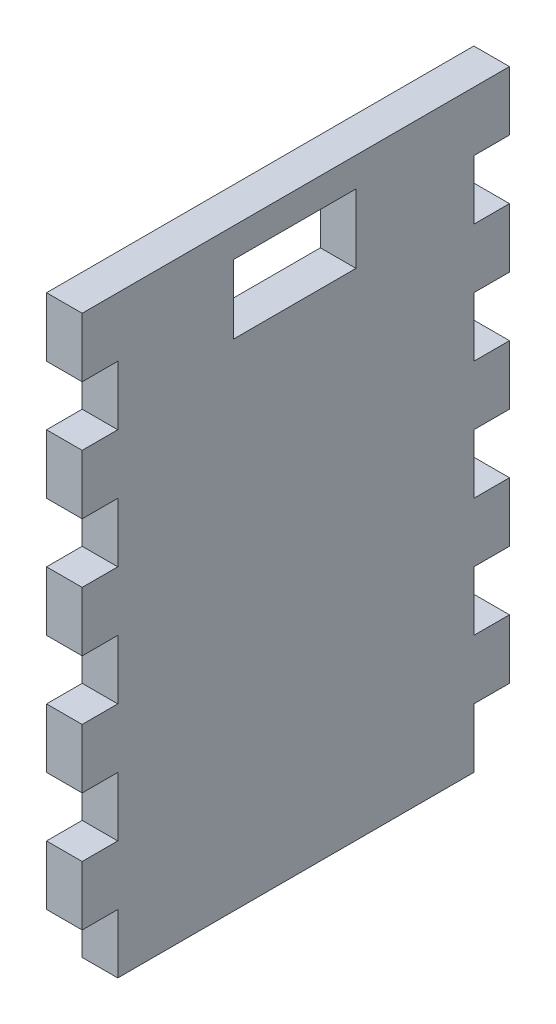
from build123d import *

# Parameters (mm, degrees)
ESBO_O1_W                = 10.3
ESBO_O1_H                = 5.8
RESSALTO_EXTRUS_O1_DEPTH = 3


with BuildPart() as part:
    # Esboço1 → Ressalto-extrusão1 (new body)
    with BuildSketch(Plane(origin=(0, 0, 0), x_dir=(0, 0, -1), z_dir=(1, 0, 0))):
        Polygon((15.984258461, 25.106612036), (15.984258461, 20.106612036), (12.984258461, 20.106612036), (12.984258461, 15.106612036), (15.984258461, 15.106612036), (15.984258461, 10.106612036), (12.984258461, 10.106612036), (12.984258461, 5.106612036), (15.984258461, 5.106612036), (15.984258461, 0.106612036), (12.984258461, 0.106612036), (12.984258461, -4.893387964), (15.984258461, -4.893387964), (15.984258461, -9.893387964), (12.984258461, -9.893387964), (12.984258461, -14.893387964), (15.984258461, -14.893387964), (15.984258461, -19.893387964), (12.984258461, -19.893387964), (12.984258461, -24.893387964), (-17.015741539, -24.893387964), (-17.015741539, -19.893387964), (-20.015741539, -19.893387964), (-20.015741539, -14.893387964), (-17.015741539, -14.893387964), (-17.015741539, -9.893387964), (-20.015741539, -9.893387964), (-20.015741539, -4.893387964), (-17.015741539, -4.893387964), (-17.015741539, 0.106612036), (-20.015741539, 0.106612036), (-20.015741539, 5.106612036), (-17.015741539, 5.106612036), (-17.015741539, 10.106612036), (-20.015741539, 10.106612036), (-20.015741539, 15.106612036), (-17.015741539, 15.106612036), (-17.015741539, 20.106612036), (-20.015741539, 20.106612036), (-20.015741539, 25.106612036), align=None)
        with Locations((-2.096516144, 19.746612036)):
            Rectangle(ESBO_O1_W, ESBO_O1_H, mode=Mode.SUBTRACT)
    extrude(amount=RESSALTO_EXTRUS_O1_DEPTH)


solid = part.part
